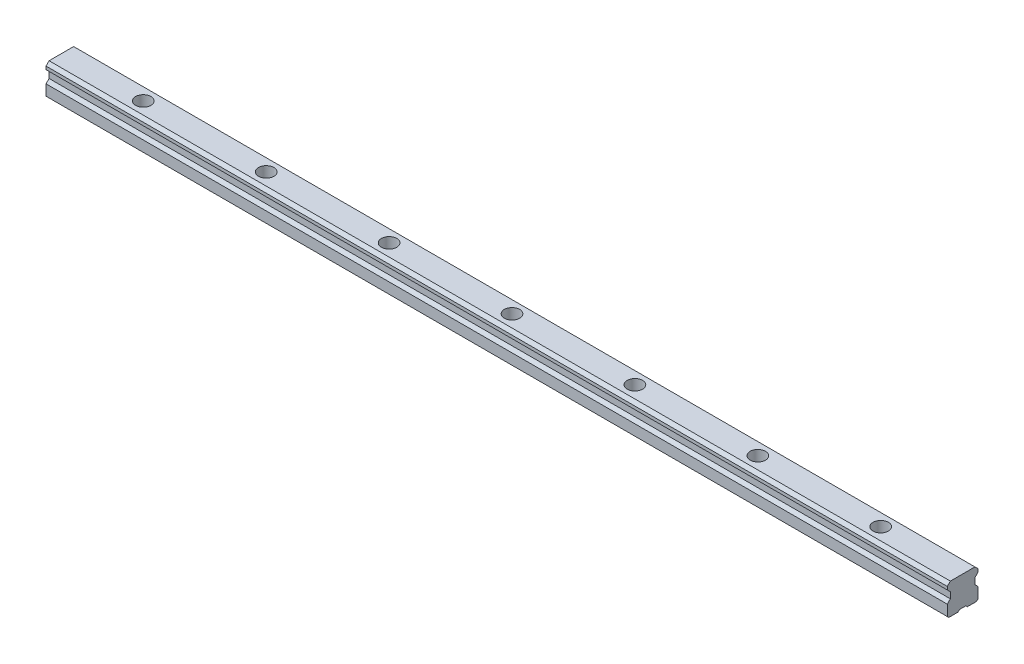
from build123d import *

# Parameters (mm, degrees)
BOSS_EXTRUDE1_DEPTH                              = 440
CUT_EXTRUDE1_DEPTH                               = 441.332899634
CBORE_FOR_M4_HEX_HEAD_MACHINE_SCREW1_D           = 4.5
CBORE_FOR_M4_HEX_HEAD_MACHINE_SCREW1_DEPTH       = 15
CBORE_FOR_M4_HEX_HEAD_MACHINE_SCREW1_CBORE_D     = 7.5
CBORE_FOR_M4_HEX_HEAD_MACHINE_SCREW1_CBORE_DEPTH = 6
CHAMFER1_SIZE                                    = 0.75
CHAMFER2_SIZE                                    = 1.060660172


with BuildPart() as part:
    # Sketch1 → Boss-Extrude1 (new body)
    with BuildSketch(Plane(origin=(250, 0, 0), x_dir=(0, 0, -1), z_dir=(1, 0, 0))):
        Polygon((-7.5, 6), (-7.5, 0), (7.5, 0), (7.5, 6), (6, 7.5), (6, 10.5), (8.25, 12.75), (6, 15), (-6, 15), (-8.25, 12.75), (-6, 10.5), (-6, 7.5), align=None)
    extrude(amount=-BOSS_EXTRUDE1_DEPTH)

    # Sketch2 → Cut-Extrude1 (cut, through all)
    with BuildSketch(Plane.ZY.offset(190)):
        Polygon((-2.25, 0), (2.25, 0), (1.5, 0.75), (-1.5, 0.75), align=None)
    extrude(amount=-CUT_EXTRUDE1_DEPTH, mode=Mode.SUBTRACT)

    # CBORE for M4 Hex Head Machine Screw1
    with Locations(Plane(origin=(0, 15, 0), x_dir=(1, 0, 0), z_dir=(0, 1, 0))):
        with Locations((210, 0), (150, 0), (90, 0), (30, 0), (-30, 0), (-90, 0), (-150, 0), (-210, 0)):
            CounterBoreHole(CBORE_FOR_M4_HEX_HEAD_MACHINE_SCREW1_D / 2, CBORE_FOR_M4_HEX_HEAD_MACHINE_SCREW1_CBORE_D / 2, CBORE_FOR_M4_HEX_HEAD_MACHINE_SCREW1_CBORE_DEPTH, depth=CBORE_FOR_M4_HEX_HEAD_MACHINE_SCREW1_DEPTH)

    # Chamfer1
    chamfer1_edges = [part.edges().sort_by_distance(p)[0] for p in [
        (30, 0, -7.5),
        (30, 0, 7.5),
    ]]
    chamfer(chamfer1_edges, length=CHAMFER1_SIZE)

    # Chamfer2
    chamfer2_edges = [part.edges().sort_by_distance(p)[0] for p in [
        (30, 12.75, 8.25),
        (30, 12.75, -8.25),
    ]]
    chamfer(chamfer2_edges, length=CHAMFER2_SIZE)


solid = part.part
